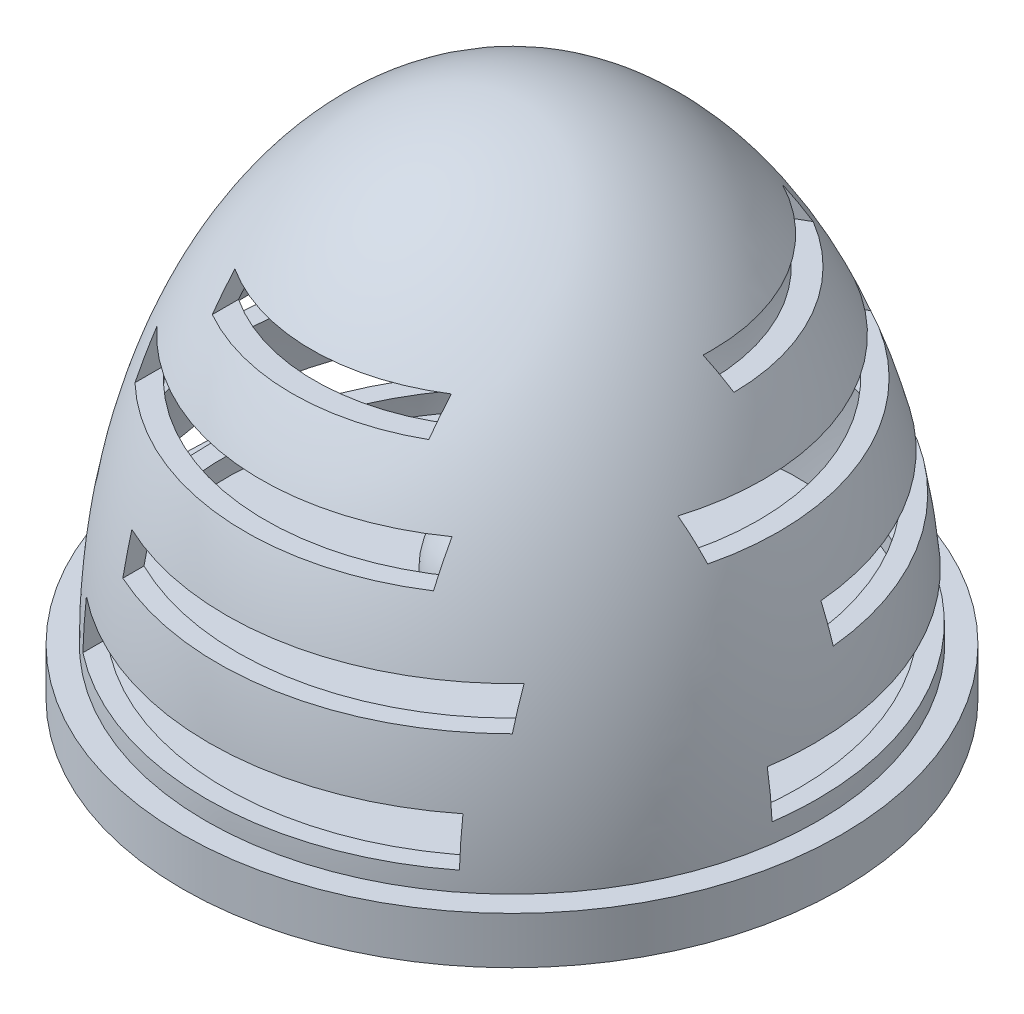
from build123d import *

# Parameters (mm, degrees)
SCHIZZO1_R                   = 35
ESTRUSIONE_ESTRUSIONE1_DEPTH = 5
SCHIZZO7_R                   = 1.5
TAGLIO_ESTRUSIONE1_DEPTH     = 5
TAGLIO_ESTRUSIONE2_START     = 40
SCHIZZO8_W                   = 35
SCHIZZO8_H                   = 4
SCHIZZO8_W_2                 = 40
SCHIZZO8_H_2                 = 5
SCHIZZO8_W_3                 = 23
SCHIZZO8_H_3                 = 3
TAGLIO_ESTRUSIONE2_DEPTH     = 25
RIPETIZIONECIRCOLARE1_COUNT  = 3
SCHIZZO10_R                  = 1.5
TAGLIO_ESTRUSIONE3_DEPTH     = 5


with BuildPart() as part:
    # Schizzo1 → Estrusione-Estrusione1 (new body)
    with BuildSketch(Plane(origin=(0, 0, 0), x_dir=(1, 0, 0), z_dir=(0, 1, 0))):
        with Locations(Location((0, 0, 0), (0, 0, 270))):
            Circle(SCHIZZO1_R)
    extrude(amount=ESTRUSIONE_ESTRUSIONE1_DEPTH)

    # Schizzo4 → Rivoluzione2 (revolve)
    with BuildSketch(Plane.XY):
        with BuildLine():
            Line((0, 55), (0, 53))
            add(Edge.make_bspline(
                [(0, 53), (1.940350747, 53), (5.771298631, 52.418859724), (11.421055276, 49.794843511), (16.718848737, 45.445760472), (21.438263559, 39.495530735), (25.352595962, 32.164290737), (28.281209659, 23.737981516), (30.091708546, 14.569044293), (30.5, 8.1725009), (30.5, 5)],
                knots=[-1.570796327, -1.570796327, -1.570796327, -1.570796327, -1.374446786, -1.178097245, -0.981747704, -0.785398163, -0.589048623, -0.392699082, -0.196349541, 0, 0, 0, 0], degree=3))
            Line((30.5, 5), (32.5, 5))
            add(Edge.make_bspline(
                [(32.5, 5), (32.5, 55), (0, 55)],
                knots=[4.71238898, 4.71238898, 4.71238898, 6.283185307, 6.283185307, 6.283185307], degree=2, weights=[1, 0.707106781, 1]))
        make_face()
    revolve(axis=Axis((0, 55, 0), (0, -1, 0)))

    # Schizzo8 → Taglio-Estrusione2 (cut)
    with BuildSketch(Plane.XY.offset(TAGLIO_ESTRUSIONE2_START)):
        with Locations((4.5993834, 20.856279125)):
            Rectangle(SCHIZZO8_W, SCHIZZO8_H)
        with Locations((0, 9.521952208)):
            Rectangle(SCHIZZO8_W_2, SCHIZZO8_H_2)
        with Locations((0, 41.256378046)):
            Rectangle(SCHIZZO8_W_3, SCHIZZO8_H_3)
        with Locations((-2.081531921, 31.513999166)):
            Rectangle(SCHIZZO8_W, SCHIZZO8_H)
    taglio_estrusione2 = extrude(amount=-TAGLIO_ESTRUSIONE2_DEPTH, mode=Mode.SUBTRACT)

    # RipetizioneCircolare1: Taglio-Estrusione2 ×3 about axis
    ripetizionecircolare1_axis = Axis((0, 0, 0), (0, 1, 0))
    for i in range(1, RIPETIZIONECIRCOLARE1_COUNT):
        add(taglio_estrusione2.rotate(ripetizionecircolare1_axis, i * 360 / RIPETIZIONECIRCOLARE1_COUNT), mode=Mode.SUBTRACT)


with BuildPart() as body_2:
    # Schizzo6 → Rivoluzione1 (revolve)
    with BuildSketch(Plane.XY):
        with BuildLine():
            Line((0, 23.502953236), (0, 5))
            ThreePointArc((0, 5), (6.900188549, 10.822121402), (2.322166976, 18.603600574))
            ThreePointArc((2.322166976, 18.603600574), (2.710909256, 21.787854402), (0, 23.502953236))
        make_face()
    revolve(axis=Axis((0, 59.282138948, 0), (0, -1, 0)))

    # Schizzo7 → Taglio-Estrusione1 (cut, symmetric)
    with BuildSketch(Plane.XY):
        with Locations(Location((0, 20.904290898, 0), (0, 0, 222.827239771))):
            Circle(SCHIZZO7_R)
    extrude(amount=TAGLIO_ESTRUSIONE1_DEPTH, both=True, mode=Mode.SUBTRACT)

    # Schizzo10 → Taglio-Estrusione3 (cut, symmetric)
    with BuildSketch(Plane(origin=(0, 0, 0), x_dir=(0, 0, -1), z_dir=(1, 0, 0))):
        with Locations(Location((0, 20.904290898, 0), (0, 0, 270))):
            Circle(SCHIZZO10_R)
    extrude(amount=TAGLIO_ESTRUSIONE3_DEPTH, both=True, mode=Mode.SUBTRACT)


solid = Compound([part.part, body_2.part])
